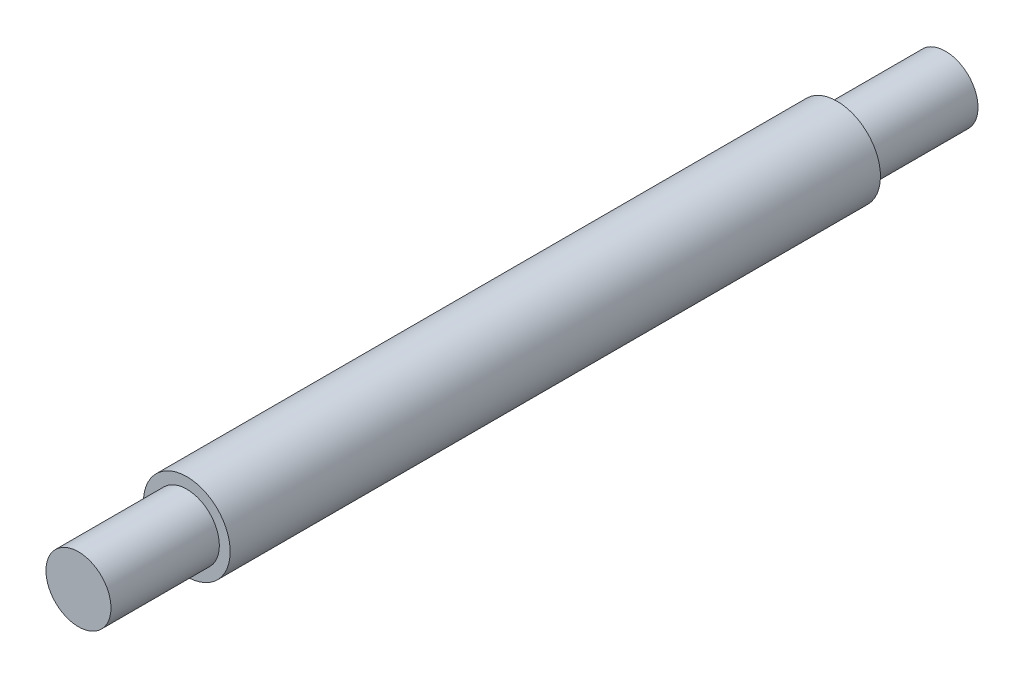
from build123d import *

# Parameters (mm, degrees)
SKETCH_1_R      = 4
EXTRUDE_1_DEPTH = 30
SKETCH_2_R      = 3
EXTRUDE_2_DEPTH = 10
EXTRUDE_START   = 10
SKETCH_3_R      = 3
EXTRUDE_3_DEPTH = 10


with BuildPart() as part:
    # 草图1 → 凸台-拉伸1 (new, symmetric)
    with BuildSketch(Plane(origin=(0, 0, 526.914147293), x_dir=(-1, 0, 0), z_dir=(0, 0, -1))):
        with Locations(Location((340.287512766, -246.15455511, 0), (0, 0, 90))):
            Circle(SKETCH_1_R)
    extrude(amount=EXTRUDE_1_DEPTH, both=True)

    # 草图2 → 凸台-拉伸2 (add)
    with BuildSketch(Plane(origin=(0, 0, 496.914147293), x_dir=(-1, 0, 0), z_dir=(0, 0, -1))):
        with Locations(Location((340.287512766, -246.15455511, 0), (0, 0, 90))):
            Circle(SKETCH_2_R)
    extrude(amount=EXTRUDE_2_DEPTH)

    # 草图3 → 凸台-拉伸3 (add)
    with BuildSketch(Plane.XY.offset(556.914147293).offset(EXTRUDE_START)):
        with Locations(Location((-340.287512766, -246.15455511, 0), (0, 0, 90))):
            Circle(SKETCH_3_R)
    extrude(amount=-EXTRUDE_3_DEPTH)


solid = part.part
